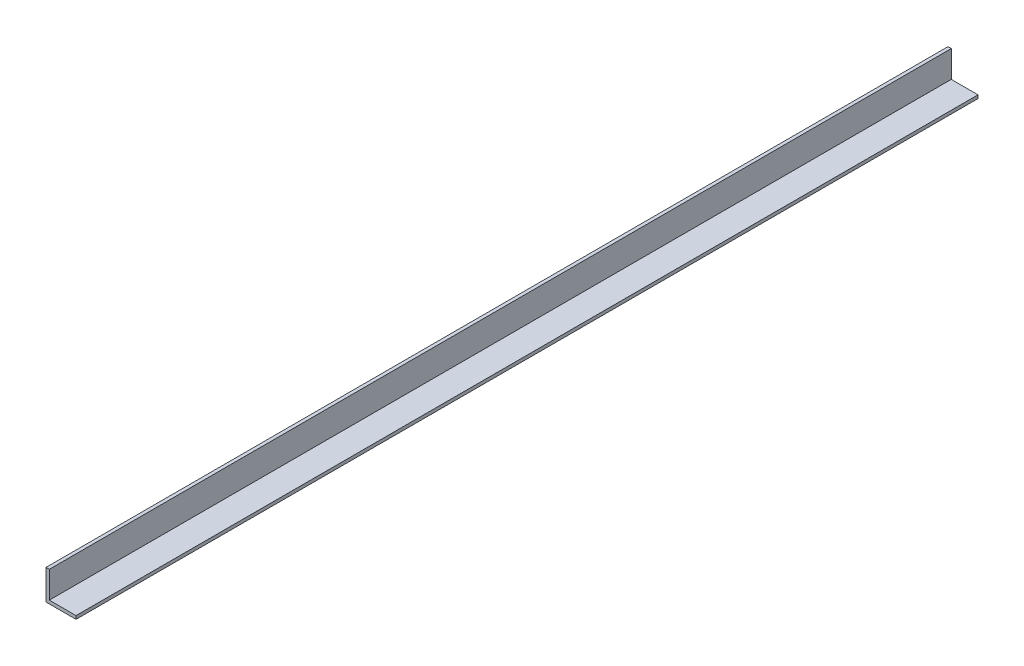
from build123d import *

# Parameters (mm, degrees)
SALIENTE_EXTRUIR1_DEPTH = 6100


with BuildPart() as part:
    # Croquis1 → Saliente-Extruir1 (new body)
    with BuildSketch(Plane.XY):
        Polygon((0, 203), (0, 0), (203, 0), (203, 22.23), (22.23, 22.23), (22.23, 203), align=None)
    extrude(amount=-SALIENTE_EXTRUIR1_DEPTH)


solid = part.part
